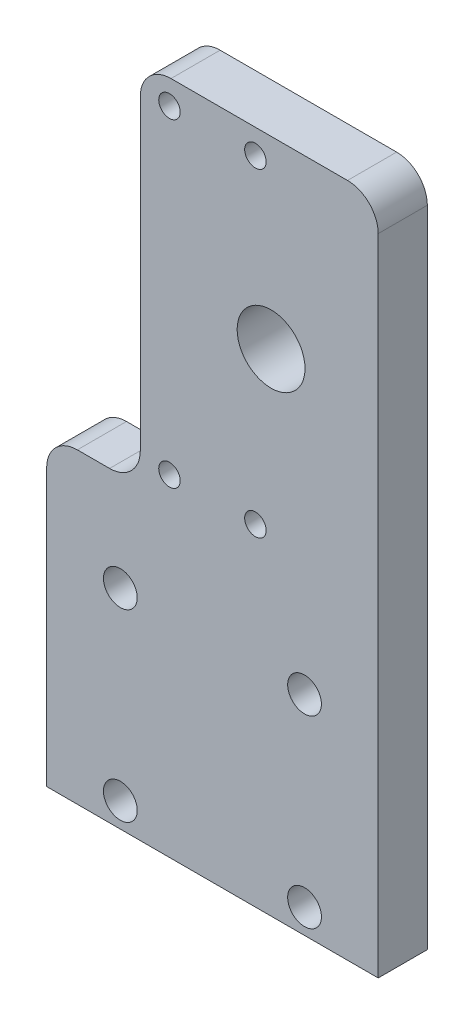
from build123d import *

# Parameters (mm, degrees)
SKETCH_1_R          = 2.75
EXTRUDE_1_DEPTH     = 8
SKETCH_2_W          = 15.25
SKETCH_2_H          = 60
CUT_EXTRUDE_1_DEPTH = 10
FILLET_1_R          = 5
SKETCH_3_R          = 1.75
CUT_EXTRUDE_2_DEPTH = 123.800651464
SKETCH_4_R          = 5.525
CUT_EXTRUDE_3_DEPTH = 10


with BuildPart() as part:
    # 草图1 → 凸台-拉伸1 (new body)
    with BuildSketch(Plane.XY):
        Polygon((0, 0), (54, 0), (54, -52), (54, -110), (0, -110), align=None)
        with Locations((12, -106)):
            Circle(SKETCH_1_R, mode=Mode.SUBTRACT)
        with Locations((42, -106)):
            Circle(SKETCH_1_R, mode=Mode.SUBTRACT)
        with Locations((42, -76)):
            Circle(SKETCH_1_R, mode=Mode.SUBTRACT)
        with Locations((12, -76)):
            Circle(SKETCH_1_R, mode=Mode.SUBTRACT)
    extrude(amount=EXTRUDE_1_DEPTH)

    # 草图2 → 切除-拉伸1 (cut)
    with BuildSketch(Plane(origin=(0, 0, 0), x_dir=(-1, 0, 0), z_dir=(0, 0, -1))):
        with Locations((-7.625, -30)):
            Rectangle(SKETCH_2_W, SKETCH_2_H)
    extrude(amount=-CUT_EXTRUDE_1_DEPTH, mode=Mode.SUBTRACT)

    # 圆角1
    fillet_1_edges = [part.edges().sort_by_distance(p)[0] for p in [
        (15.25, 0, 4),
        (0, -60, 4),
        (15.25, -60, 4),
        (54, 0, 4),
    ]]
    fillet(fillet_1_edges, radius=FILLET_1_R)

    # 草图3 → 切除-拉伸2 (cut, through all)
    with BuildSketch(Plane(origin=(0, 0, 0), x_dir=(-1, 0, 0), z_dir=(0, 0, -1))):
        with Locations((-20, -4)):
            Circle(SKETCH_3_R)
        with Locations((-34, -4)):
            Circle(SKETCH_3_R)
        with Locations((-34, -56)):
            Circle(SKETCH_3_R)
        with Locations((-20, -56)):
            Circle(SKETCH_3_R)
    extrude(amount=-CUT_EXTRUDE_2_DEPTH, mode=Mode.SUBTRACT)

    # 草图4 → 切除-拉伸3 (cut)
    with BuildSketch(Plane(origin=(0, 0, 0), x_dir=(-1, 0, 0), z_dir=(0, 0, -1))):
        with Locations((-36.55, -30)):
            Circle(SKETCH_4_R)
    extrude(amount=-CUT_EXTRUDE_3_DEPTH, mode=Mode.SUBTRACT)


solid = part.part
